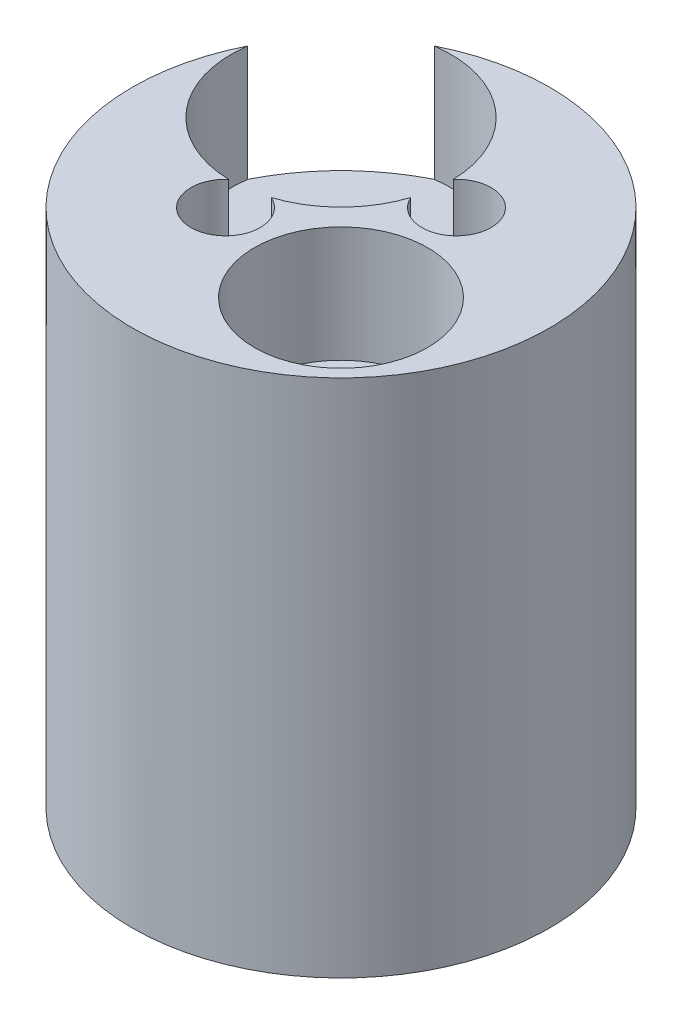
from build123d import *

# Parameters (mm, degrees)
SKETCH1_R           = 91.7575
BOSS_EXTRUDE1_DEPTH = 228.6
SKETCH2_R           = 48.26
SKETCH2_R_2         = 38.1
CUT_EXTRUDE1_DEPTH  = 50.8
SKETCH4_R           = 15.24
CUT_EXTRUDE2_DEPTH  = 177.8
SKETCH5_R           = 15.24
CUT_EXTRUDE3_DEPTH  = 177.8
SKETCH6_R           = 38.1
CUT_EXTRUDE9_DEPTH  = 50.8


with BuildPart() as part:
    # Sketch1 → Boss-Extrude1 (new body)
    with BuildSketch(Plane(origin=(0, 0, 0), x_dir=(1, 0, 0), z_dir=(0, 1, 0))):
        with Locations(Location((0, 0, 0), (0, 0, 270))):
            Circle(SKETCH1_R)
    extrude(amount=BOSS_EXTRUDE1_DEPTH)

    # Sketch2 → Cut-Extrude1 (cut)
    with BuildSketch(Plane(origin=(0, 228.6, 0), x_dir=(1, 0, 0), z_dir=(0, 1, 0))):
        with Locations((-34.29, 34.29)):
            Circle(SKETCH2_R)
        with Locations(Location((34.29, -34.29, 0), (0, 0, 270))):
            Circle(SKETCH2_R_2)
    extrude(amount=-CUT_EXTRUDE1_DEPTH, mode=Mode.SUBTRACT)

    # Sketch4 → Cut-Extrude2 (cut)
    with BuildSketch(Plane(origin=(0, 228.6, 0), x_dir=(1, 0, 0), z_dir=(0, 1, 0))):
        with Locations(Location((25.4, 25.4, 0), (0, 0, 270))):
            Circle(SKETCH4_R)
        with Locations(Location((-25.4, -25.4, 0), (0, 0, 270))):
            Circle(SKETCH4_R)
    extrude(amount=-CUT_EXTRUDE2_DEPTH, mode=Mode.SUBTRACT)

    # Sketch5 → Cut-Extrude3 (cut)
    with BuildSketch(Plane.XZ):
        with Locations(Location((-25.4, -25.4, 0), (0, 0, 270))):
            Circle(SKETCH5_R)
        with Locations(Location((25.4, 25.4, 0), (0, 0, 270))):
            Circle(SKETCH5_R)
    extrude(amount=-CUT_EXTRUDE3_DEPTH, mode=Mode.SUBTRACT)

    # Sketch6 → Cut-Extrude9 (cut)
    with BuildSketch(Plane.XZ):
        with Locations(Location((-34.29, 34.29, 0), (0, 0, 270))):
            Circle(SKETCH6_R)
        with Locations(Location((34.29, -34.29, 0), (0, 0, 270))):
            Circle(SKETCH6_R)
    extrude(amount=-CUT_EXTRUDE9_DEPTH, mode=Mode.SUBTRACT)


solid = part.part
